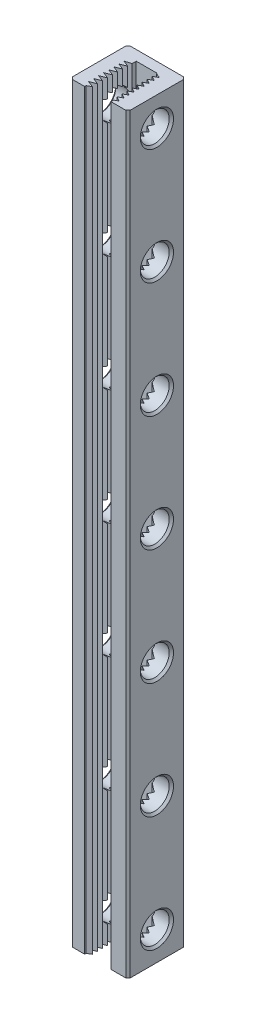
from build123d import *

# Parameters (mm, degrees)
SKETCH1_W                  = 8
SKETCH1_H                  = 8
BOSS_EXTRUDE1_DEPTH        = 300
CUT_EXTRUDE1_DEPTH         = 301.213257535
SKETCH3_R                  = 2
CUT_EXTRUDE2_DEPTH         = 301.213257535
CHAMFER1_SIZE              = 0.3
CHAMFER2_SIZE              = 0.3
LPATTERN1_COUNT            = 19
LPATTERN1_PITCH            = 16
CHAMFER1_OF_LPATTERN1_SIZE = 0.3
SKETCH4_W                  = 8
SKETCH4_H                  = 196
CUT_EXTRUDE3_DEPTH         = 301.213257535


with BuildPart() as part:
    # Sketch1 → Boss-Extrude1 (new body)
    with BuildSketch(Plane(origin=(0, 0, 0), x_dir=(1, 0, 0), z_dir=(0, 1, 0))):
        with Locations((4, 4)):
            Rectangle(SKETCH1_W, SKETCH1_H)
    extrude(amount=BOSS_EXTRUDE1_DEPTH)

    # Sketch2 → Cut-Extrude1 (cut, through all)
    with BuildSketch(Plane.XZ):
        Polygon((5.652029979, 0), (2.008445554, 0), (2.008445554, -0.208206305), (2.54, -0.515099407), (1.673719601, -0.865099407), (2.54, -1.215099407), (1.673719601, -1.572712655), (2.54, -1.915099407), (1.673719601, -2.265099407), (2.54, -2.615099407), (1.673719601, -2.965099407), (2.54, -3.315099407), (1.673719601, -3.665099407), (2.54, -4.015099407), (1.673719601, -4.365099407), (2.54, -4.715099407), (1.673719601, -5.065099407), (2.54, -5.415099407), (1.673719601, -5.765099407), (2.54, -6.026380467), (2.54, -6.6), (5.46, -6.6), (5.46, -6.49878106), (6.106693316, -6.2375), (5.46, -5.8875), (6.106693316, -5.5375), (5.46, -5.1875), (6.106693316, -4.8375), (5.46, -4.4875), (6.106693316, -4.1375), (5.46, -3.7875), (6.106693316, -3.4375), (5.46, -3.0875), (6.106693316, -2.7375), (5.46, -2.3875), (6.106693316, -2.0375), (5.46, -1.6875), (6.106693316, -1.345113247), (5.46, -0.9875), (6.106693316, -0.6375), (5.652029979, -0.375), align=None)
    extrude(amount=-CUT_EXTRUDE1_DEPTH, mode=Mode.SUBTRACT)

    # Sketch3 → Cut-Extrude2 (cut, through all)
    with BuildSketch(Plane(origin=(8, 0, 0), x_dir=(0, 0, -1), z_dir=(1, 0, 0))):
        with Locations((4, 4)):
            Circle(SKETCH3_R)
    cut_extrude2 = extrude(amount=-CUT_EXTRUDE2_DEPTH, mode=Mode.SUBTRACT)

    # Chamfer1
    chamfer1_edges = [part.edges().sort_by_distance(p)[0] for p in [
        (0, 4, -2),
        (8, 4, -2),
    ]]
    chamfer(chamfer1_edges, length=CHAMFER1_SIZE)

    # Chamfer2
    chamfer2_edges = [part.edges().sort_by_distance(p)[0] for p in [
        (0, 150, -8),
        (8, 150, -8),
        (8, 150, 0),
        (0, 150, 0),
    ]]
    chamfer(chamfer2_edges, length=CHAMFER2_SIZE)

    # LPattern1: Cut-Extrude2 ×19
    with Locations(*[(0, i * LPATTERN1_PITCH, 0) for i in range(1, LPATTERN1_COUNT)]):
        add(cut_extrude2, mode=Mode.SUBTRACT)

    # Chamfer1 of LPattern1
    chamfer1_of_lpattern1_edges = [part.edges().sort_by_distance(p)[0] for p in [
        (0, 20, -2),
        (8, 20, -2),
        (0, 36, -2),
        (8, 36, -2),
        (0, 52, -2),
        (8, 52, -2),
        (0, 68, -2),
        (8, 68, -2),
        (0, 84, -2),
        (8, 84, -2),
        (0, 100, -2),
        (8, 100, -2),
        (0, 116, -2),
        (8, 116, -2),
        (0, 132, -2),
        (8, 132, -2),
        (0, 148, -2),
        (8, 148, -2),
        (0, 164, -2),
        (8, 164, -2),
        (0, 180, -2),
        (8, 180, -2),
        (0, 196, -2),
        (8, 196, -2),
        (0, 212, -2),
        (8, 212, -2),
        (0, 228, -2),
        (8, 228, -2),
        (0, 244, -2),
        (8, 244, -2),
        (0, 260, -2),
        (8, 260, -2),
        (0, 276, -2),
        (8, 276, -2),
        (0, 292, -2),
        (8, 292, -2),
    ]]
    chamfer(chamfer1_of_lpattern1_edges, length=CHAMFER1_OF_LPATTERN1_SIZE)

    # Sketch4 → Cut-Extrude3 (cut, through all)
    with BuildSketch(Plane(origin=(8, 0, 0), x_dir=(0, 0, -1), z_dir=(1, 0, 0))):
        with Locations((4, 202)):
            Rectangle(SKETCH4_W, SKETCH4_H)
    extrude(amount=-CUT_EXTRUDE3_DEPTH, mode=Mode.SUBTRACT)


solid = part.part
